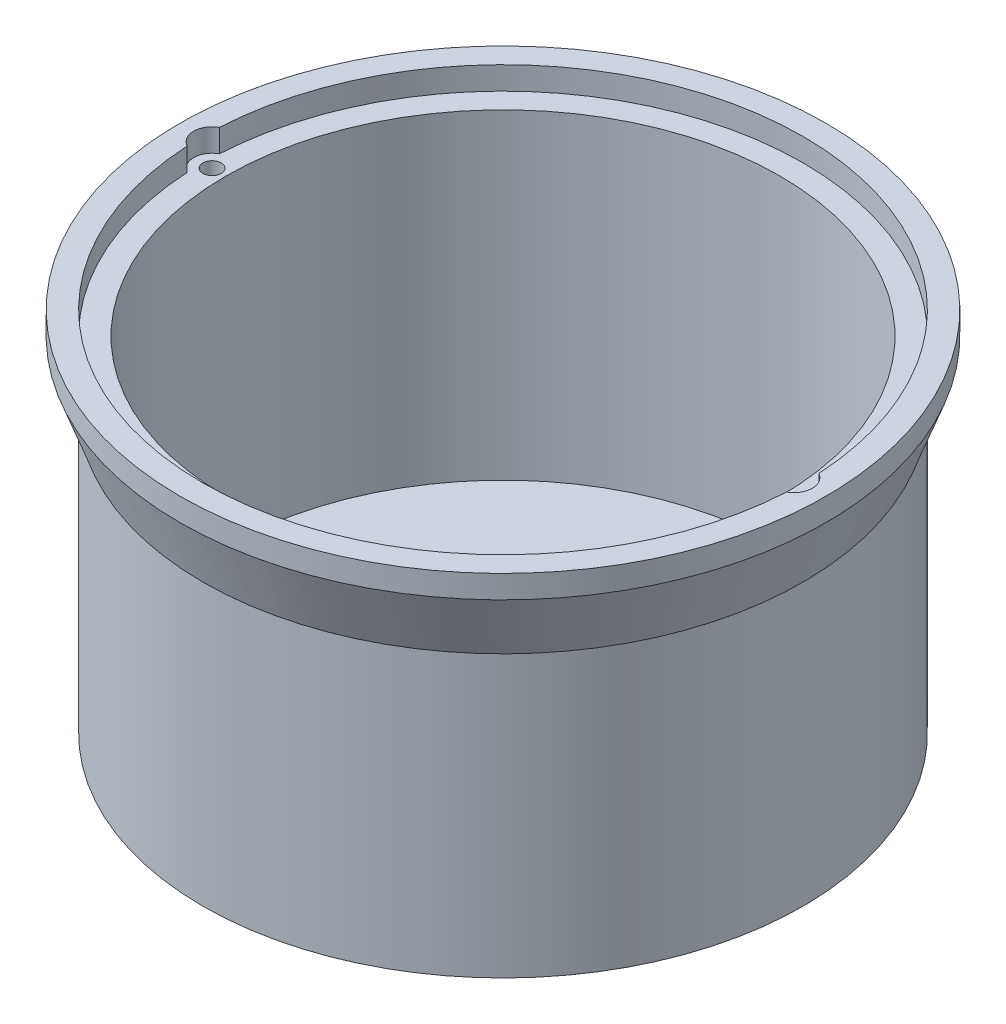
from build123d import *

# Parameters (mm, degrees)
SKETCH2_R          = 4
SKETCH2_R_2        = 2
CUT_EXTRUDE1_DEPTH = 125.761772992
SKETCH2_4_R        = 2
CUT_EXTRUDE3_DEPTH = 3


with BuildPart() as part:
    # Sketch1 → Revolve1 (revolve)
    with BuildSketch(Plane.XY):
        Polygon((-65.5, 0), (0, 0), (0, 5), (-60.5, 5), (-60.5, 75), (-65.5, 75), (-65.5, 80), (-70.5, 80), (-70.5, 75), (-65.5, 61.262612903), align=None)
    revolve(axis=Axis((0, 5, 0), (0, -1, 0)))

    # Sketch2 → Cut-Extrude1 (cut, through all)
    # profile 1 of 2: a face of its own
    with BuildSketch(Plane(origin=(0, 75, 0), x_dir=(1, 0, 0), z_dir=(0, 1, 0))):
        with Locations((-63.5, 0)):
            Circle(SKETCH2_R)
        with Locations((-63.5, 0)):
            Circle(SKETCH2_R_2, mode=Mode.SUBTRACT)
    # profile 2 of 2: a face of its own
    with BuildSketch(Plane(origin=(0, 75, 0), x_dir=(1, 0, 0), z_dir=(0, 1, 0))):
        with Locations((63.5, 0)):
            Circle(SKETCH2_R)
        with Locations((63.5, 0)):
            Circle(SKETCH2_R_2, mode=Mode.SUBTRACT)
    extrude(amount=CUT_EXTRUDE1_DEPTH, mode=Mode.SUBTRACT)

    # Sketch2<4> → Cut-Extrude3 (cut)
    with BuildSketch(Plane(origin=(0, 75, 0), x_dir=(1, 0, 0), z_dir=(0, 1, 0))):
        with Locations((-63.5, 0)):
            Circle(SKETCH2_4_R)
        with Locations((63.5, 0)):
            Circle(SKETCH2_4_R)
    extrude(amount=-CUT_EXTRUDE3_DEPTH, mode=Mode.SUBTRACT)


solid = part.part
